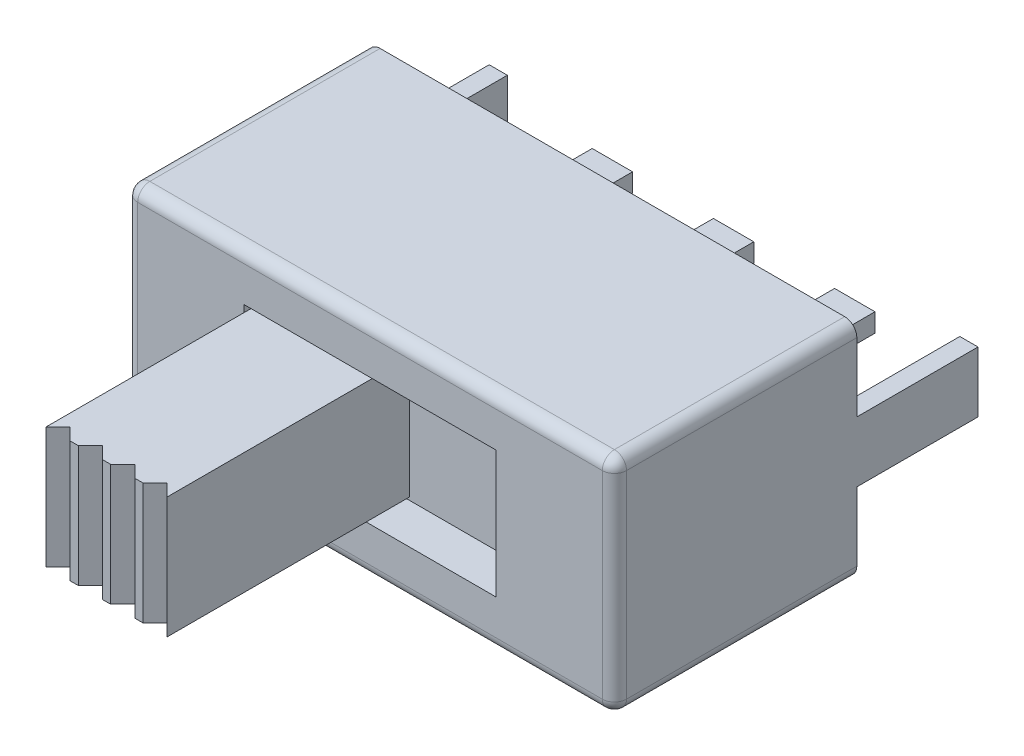
from build123d import *

# Parameters (mm, degrees)
SKETCH_3_W          = 12.1
SKETCH_3_H          = 5.5
EXTRUDE_1_DEPTH     = 6
SKETCH_4_W          = 6.24
SKETCH_4_H          = 3.15
CUT_EXTRUDE_1_DEPTH = 1
SKETCH_5_W          = 3
SKETCH_5_H          = 3
EXTRUDE_2_DEPTH     = 6
CUT_EXTRUDE_2_REACH = 18.896
SKETCH_7_W          = 1
SKETCH_7_H          = 0.46
SKETCH_7_W_2        = 0.45
SKETCH_7_H_2        = 1.5
EXTRUDE_3_DEPTH     = 3
FILLET_1_R          = 0.3


with BuildPart() as part:
    # 草图3 → 凸台-拉伸1 (new body)
    with BuildSketch(Plane.XY):
        with Locations((6.05, 2.75)):
            Rectangle(SKETCH_3_W, SKETCH_3_H)
    extrude(amount=EXTRUDE_1_DEPTH)

    # 草图4 → 切除-拉伸1 (cut)
    with BuildSketch(Plane.XY.offset(6)):
        with Locations((6.05, 2.75)):
            Rectangle(SKETCH_4_W, SKETCH_4_H)
    extrude(amount=-CUT_EXTRUDE_1_DEPTH, mode=Mode.SUBTRACT)

    # 草图5 → 凸台-拉伸2 (add)
    with BuildSketch(Plane.XY.offset(5)):
        with Locations((4.53, 2.75)):
            Rectangle(SKETCH_5_W, SKETCH_5_H)
    extrude(amount=EXTRUDE_2_DEPTH)

    # 草图6 → 切除-拉伸2 (cut, up to next)
    with BuildSketch(Plane.XZ.offset(-1.25), mode=Mode.PRIVATE) as cut_extrude_2_sk1:
        Polygon((3.03, 11), (3.33, 10.7), (3.63, 11), align=None)
    cut_extrude_2_tool1 = extrude(cut_extrude_2_sk1.sketch, amount=-CUT_EXTRUDE_2_REACH, mode=Mode.PRIVATE) & part.part
    # 草图6 → 切除-拉伸2 (cut, up to next)
    with BuildSketch(Plane.XZ.offset(-1.25), mode=Mode.PRIVATE) as cut_extrude_2_sk2:
        Polygon((4.13, 10.7), (4.43, 11), (3.83, 11), align=None)
    cut_extrude_2_tool2 = extrude(cut_extrude_2_sk2.sketch, amount=-CUT_EXTRUDE_2_REACH, mode=Mode.PRIVATE) & part.part
    # 草图6 → 切除-拉伸2 (cut, up to next)
    with BuildSketch(Plane.XZ.offset(-1.25), mode=Mode.PRIVATE) as cut_extrude_2_sk3:
        Polygon((4.93, 10.7), (5.23, 11), (4.63, 11), align=None)
    cut_extrude_2_tool3 = extrude(cut_extrude_2_sk3.sketch, amount=-CUT_EXTRUDE_2_REACH, mode=Mode.PRIVATE) & part.part
    # 草图6 → 切除-拉伸2 (cut, up to next)
    with BuildSketch(Plane.XZ.offset(-1.25), mode=Mode.PRIVATE) as cut_extrude_2_sk4:
        Polygon((5.73, 10.7), (6.03, 11), (5.43, 11), align=None)
    cut_extrude_2_tool4 = extrude(cut_extrude_2_sk4.sketch, amount=-CUT_EXTRUDE_2_REACH, mode=Mode.PRIVATE) & part.part
    add(cut_extrude_2_tool1.solids().sort_by_distance((3.33, 1.25, 10.9))[0], mode=Mode.SUBTRACT)
    add(cut_extrude_2_tool2.solids().sort_by_distance((4.13, 1.25, 10.9))[0], mode=Mode.SUBTRACT)
    add(cut_extrude_2_tool3.solids().sort_by_distance((4.93, 1.25, 10.9))[0], mode=Mode.SUBTRACT)
    add(cut_extrude_2_tool4.solids().sort_by_distance((5.73, 1.25, 10.9))[0], mode=Mode.SUBTRACT)

    # 草图7 → 凸台-拉伸3 (add)
    with BuildSketch(Plane(origin=(0, 0, 0), x_dir=(-1, 0, 0), z_dir=(0, 0, -1))):
        with Locations((-3.05, 2.75)):
            Rectangle(SKETCH_7_W, SKETCH_7_H)
        with Locations((-6.05, 2.75)):
            Rectangle(SKETCH_7_W, SKETCH_7_H)
        with Locations((-9.05, 2.75)):
            Rectangle(SKETCH_7_W, SKETCH_7_H)
        with Locations((-11.875, 2.75)):
            Rectangle(SKETCH_7_W_2, SKETCH_7_H_2)
        with Locations((-0.225, 2.75)):
            Rectangle(SKETCH_7_W_2, SKETCH_7_H_2)
    extrude(amount=EXTRUDE_3_DEPTH)

    # 圆角1
    fillet_1_edges = [part.edges().sort_by_distance(p)[0] for p in [
        (0, 2.75, 6),
        (0, 0, 3),
        (6.05, 0, 6),
        (12.1, 0, 3),
        (12.1, 2.75, 6),
        (12.1, 5.5, 3),
        (6.05, 5.5, 6),
        (0, 5.5, 3),
    ]]
    fillet(fillet_1_edges, radius=FILLET_1_R)


solid = part.part
